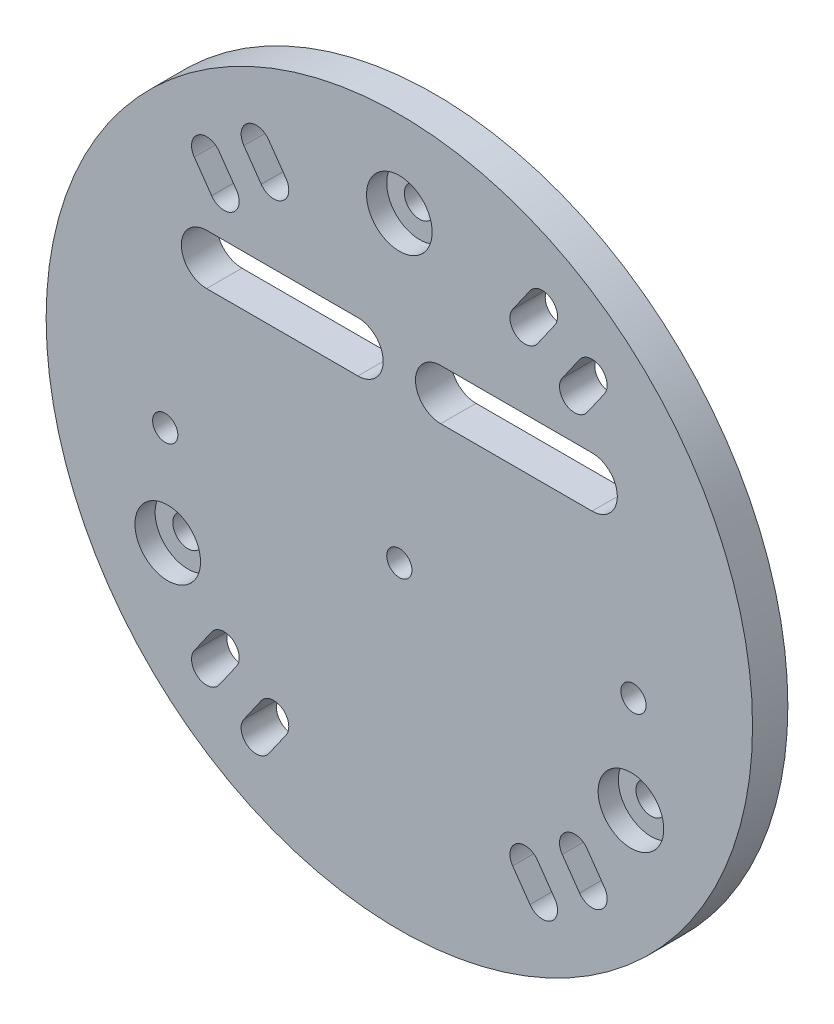
from build123d import *

# Parameters (mm, degrees)
CROQUIS2_R              = 35
SALIENTE_EXTRUIR1_DEPTH = 3.5
CORTAR_EXTRUIR3_DEPTH   = 50.621064076
CORTAR_EXTRUIR4_START   = -3.5
CROQUIS4_R              = 1.25
CORTAR_EXTRUIR4_DEPTH   = 54.121064076
CROQUIS6_R              = 3.25
CORTAR_EXTRUIR6_DEPTH   = 2
CROQUIS7_R              = 1.5
CORTAR_EXTRUIR7_DEPTH   = 50.621064076
CORTAR_EXTRUIR9_DEPTH   = 50.621064076


with BuildPart() as part:
    # Croquis2 → Saliente-Extruir1 (new body)
    with BuildSketch(Plane.XY):
        Circle(CROQUIS2_R)
    extrude(amount=SALIENTE_EXTRUIR1_DEPTH)

    # Croquis3 → Cortar-Extruir3 (cut, through all)
    with BuildSketch(Plane.XY):
        with BuildLine():
            Line((11.226803146, 23.879047115), (12.947532455, 26.336503248))
            ThreePointArc((12.947532455, 26.336503248), (15.036625176, 26.70486666), (15.404988588, 24.615773939))
            Line((15.404988588, 24.615773939), (13.684259279, 22.158317806))
            ThreePointArc((13.684259279, 22.158317806), (11.595166558, 21.789954394), (11.226803146, 23.879047115))
        make_face()
        with BuildLine():
            Line((18.599171544, 18.716859188), (20.319900853, 21.174315321))
            ThreePointArc((20.319900853, 21.174315321), (19.951537442, 23.263408042), (17.862444721, 22.89504463))
            Line((17.862444721, 22.89504463), (16.141715412, 20.437588497))
            ThreePointArc((16.141715412, 20.437588497), (16.510078823, 18.348495776), (18.599171544, 18.716859188))
        make_face()
        with BuildLine():
            Line((18.599171544, -18.716859188), (20.319900853, -21.174315321))
            ThreePointArc((20.319900853, -21.174315321), (19.951537442, -23.263408042), (17.862444721, -22.89504463))
            Line((17.862444721, -22.89504463), (16.141715412, -20.437588497))
            ThreePointArc((16.141715412, -20.437588497), (16.510078823, -18.348495776), (18.599171544, -18.716859188))
        make_face()
        with BuildLine():
            Line((11.226803146, -23.879047115), (12.947532455, -26.336503248))
            ThreePointArc((12.947532455, -26.336503248), (15.036625176, -26.70486666), (15.404988588, -24.615773939))
            Line((15.404988588, -24.615773939), (13.684259279, -22.158317806))
            ThreePointArc((13.684259279, -22.158317806), (11.595166558, -21.789954394), (11.226803146, -23.879047115))
        make_face()
        with BuildLine():
            Line((-11.226803146, -23.879047115), (-12.947532455, -26.336503248))
            ThreePointArc((-12.947532455, -26.336503248), (-15.036625176, -26.70486666), (-15.404988588, -24.615773939))
            Line((-15.404988588, -24.615773939), (-13.684259279, -22.158317806))
            ThreePointArc((-13.684259279, -22.158317806), (-11.595166558, -21.789954394), (-11.226803146, -23.879047115))
        make_face()
        with BuildLine():
            Line((-18.599171544, -18.716859188), (-20.319900853, -21.174315321))
            ThreePointArc((-20.319900853, -21.174315321), (-19.951537442, -23.263408042), (-17.862444721, -22.89504463))
            Line((-17.862444721, -22.89504463), (-16.141715412, -20.437588497))
            ThreePointArc((-16.141715412, -20.437588497), (-16.510078823, -18.348495776), (-18.599171544, -18.716859188))
        make_face()
        with BuildLine():
            Line((-18.599171544, 18.716859188), (-20.319900853, 21.174315321))
            ThreePointArc((-20.319900853, 21.174315321), (-19.951537442, 23.263408042), (-17.862444721, 22.89504463))
            Line((-17.862444721, 22.89504463), (-16.141715412, 20.437588497))
            ThreePointArc((-16.141715412, 20.437588497), (-16.510078823, 18.348495776), (-18.599171544, 18.716859188))
        make_face()
        with BuildLine():
            Line((-11.226803146, 23.879047115), (-12.947532455, 26.336503248))
            ThreePointArc((-12.947532455, 26.336503248), (-15.036625176, 26.70486666), (-15.404988588, 24.615773939))
            Line((-15.404988588, 24.615773939), (-13.684259279, 22.158317806))
            ThreePointArc((-13.684259279, 22.158317806), (-11.595166558, 21.789954394), (-11.226803146, 23.879047115))
        make_face()
    extrude(amount=CORTAR_EXTRUIR3_DEPTH, mode=Mode.SUBTRACT)

    # Croquis4 → Cortar-Extruir4 (cut, through all)
    with BuildSketch(Plane.XY.offset(3.5).offset(CORTAR_EXTRUIR4_START)):
        with Locations((-23.2, -3.5)):
            Circle(CROQUIS4_R)
        with Locations((23.2, -3.5)):
            Circle(CROQUIS4_R)
        with Locations((0, -3.5)):
            Circle(CROQUIS4_R)
    extrude(amount=CORTAR_EXTRUIR4_DEPTH, mode=Mode.SUBTRACT)

    # Croquis6 → Cortar-Extruir6 (cut)
    with BuildSketch(Plane.XY.offset(3.5)):
        with Locations((0, 26.5)):
            Circle(CROQUIS6_R)
        with Locations((22.9496732, -13.25)):
            Circle(CROQUIS6_R)
        with Locations((-22.9496732, -13.25)):
            Circle(CROQUIS6_R)
    extrude(amount=-CORTAR_EXTRUIR6_DEPTH, mode=Mode.SUBTRACT)

    # Croquis7 → Cortar-Extruir7 (cut, through all)
    with BuildSketch(Plane.XY.offset(3.5)):
        with Locations((0, 26.5)):
            Circle(CROQUIS7_R)
        with Locations((22.9496732, -13.25)):
            Circle(CROQUIS7_R)
        with Locations((-22.9496732, -13.25)):
            Circle(CROQUIS7_R)
    extrude(amount=-CORTAR_EXTRUIR7_DEPTH, mode=Mode.SUBTRACT)

    # Croquis10 → Cortar-Extruir9 (cut, through all)
    with BuildSketch(Plane.XY.offset(3.5)):
        with BuildLine():
            Line((-19.1, 15.5), (-4.1, 15.5))
            ThreePointArc((-4.1, 15.5), (-1.6, 13), (-4.1, 10.5))
            Line((-4.1, 10.5), (-19.1, 10.5))
            ThreePointArc((-19.1, 10.5), (-21.6, 13), (-19.1, 15.5))
        make_face()
        with BuildLine():
            Line((19.1, 15.5), (4.1, 15.5))
            ThreePointArc((4.1, 15.5), (1.6, 13), (4.1, 10.5))
            Line((4.1, 10.5), (19.1, 10.5))
            ThreePointArc((19.1, 10.5), (21.6, 13), (19.1, 15.5))
        make_face()
    extrude(amount=-CORTAR_EXTRUIR9_DEPTH, mode=Mode.SUBTRACT)


solid = part.part
